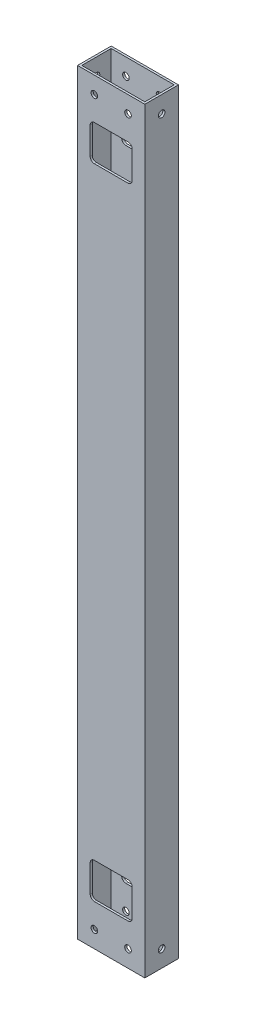
from build123d import *

# Parameters (mm, degrees)
SKETCH1_W               = 50.8
SKETCH1_H               = 571.5
BOSS_EXTRUDE1_DEPTH     = 12.7
SHELL1_T                = -1.5875
CUT_EXTRUDE1_DEPTH      = 288.157643987
CUT_EXTRUDE1_DEPTH_BACK = 288.157643987
SKETCH2_R               = 2.4892
CUT_EXTRUDE2_DEPTH      = 288.157643987
CUT_EXTRUDE2_DEPTH_BACK = 288.157643987
SKETCH3_R               = 2.4892
SKETCH4_W               = 31.75
SKETCH4_H               = 26.9875
CUT_EXTRUDE3_DEPTH      = 288.157643987
FILLET1_R               = 3.175
FILLET1_OF_MIRROR1_R    = 3.175
FILLET2_R               = 3.175


with BuildPart() as part:
    # Sketch1 → Boss-Extrude1 (new, symmetric)
    with BuildSketch(Plane.XY):
        Rectangle(SKETCH1_W, SKETCH1_H)
    extrude(amount=BOSS_EXTRUDE1_DEPTH, both=True)

    # Shell1
    shell1_openings = [part.faces().sort_by_distance(p)[0] for p in [
        (0, -285.75, 0),
        (0, 285.75, 0),
    ]]
    offset(amount=SHELL1_T, openings=shell1_openings, kind=Kind.INTERSECTION)

    # Sketch2 → Cut-Extrude1 (cut, two sides: drawn at the far end of the back side and taken through both)
    with BuildSketch(Plane.XY.offset(-CUT_EXTRUDE1_DEPTH_BACK)):
        with Locations((-12.7, -273.05)):
            Circle(SKETCH2_R)
        with Locations((12.7, -273.05)):
            Circle(SKETCH2_R)
        with Locations(Location((12.7, 273.05, 0), (0, 0, 180))):
            Circle(SKETCH2_R)
        with Locations(Location((-12.7, 273.05, 0), (0, 0, 180))):
            Circle(SKETCH2_R)
    extrude(amount=CUT_EXTRUDE1_DEPTH + CUT_EXTRUDE1_DEPTH_BACK, mode=Mode.SUBTRACT)

    # Sketch3 → Cut-Extrude2 (cut, two sides: drawn at the far end of the back side and taken through both)
    with BuildSketch(Plane(origin=(0, 0, 0), x_dir=(0, 0, -1), z_dir=(1, 0, 0)).offset(-CUT_EXTRUDE2_DEPTH_BACK)):
        with Locations((0, -273.05)):
            Circle(SKETCH3_R)
        with Locations((0, 273.05)):
            Circle(SKETCH3_R)
    extrude(amount=CUT_EXTRUDE2_DEPTH + CUT_EXTRUDE2_DEPTH_BACK, mode=Mode.SUBTRACT)

    # Sketch4 → Cut-Extrude3 (cut, symmetric)
    with BuildSketch(Plane.XY):
        with Locations((0, 241.3)):
            Rectangle(SKETCH4_W, SKETCH4_H)
    cut_extrude3 = extrude(amount=CUT_EXTRUDE3_DEPTH, both=True, mode=Mode.SUBTRACT)

    # Fillet1
    fillet1_edges = [part.edges().sort_by_distance(p)[0] for p in [
        (-15.875, 227.80625, -11.90625),
        (-15.875, 254.79375, -11.90625),
        (15.875, 254.79375, -11.90625),
        (15.875, 227.80625, -11.90625),
    ]]
    fillet(fillet1_edges, radius=FILLET1_R)

    # Mirror1: Cut-Extrude3 across plane
    add(cut_extrude3.mirror(Plane.ZX), mode=Mode.SUBTRACT)

    # Fillet1 of Mirror1
    fillet1_of_mirror1_edges = [part.edges().sort_by_distance(p)[0] for p in [
        (-15.875, -227.80625, -11.90625),
        (-15.875, -254.79375, -11.90625),
        (15.875, -254.79375, -11.90625),
        (15.875, -227.80625, -11.90625),
    ]]
    fillet(fillet1_of_mirror1_edges, radius=FILLET1_OF_MIRROR1_R)

    # Fillet2
    fillet2_edges = [part.edges().sort_by_distance(p)[0] for p in [
        (-15.875, -254.79375, 11.90625),
        (-15.875, -227.80625, 11.90625),
        (15.875, -227.80625, 11.90625),
        (15.875, -254.79375, 11.90625),
        (-15.875, 227.80625, 11.90625),
        (-15.875, 254.79375, 11.90625),
        (15.875, 254.79375, 11.90625),
        (15.875, 227.80625, 11.90625),
    ]]
    fillet(fillet2_edges, radius=FILLET2_R)


solid = part.part
